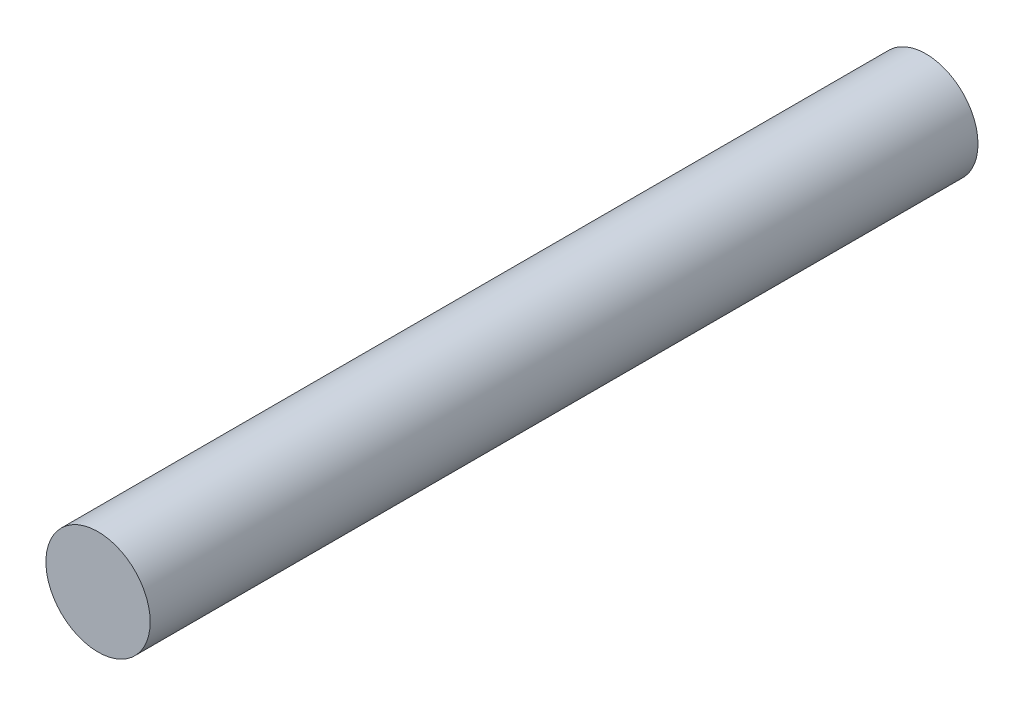
from build123d import *

# Parameters (mm, degrees)
SKETCH1_R           = 1.999996
BOSS_EXTRUDE1_DEPTH = 31.75


with BuildPart() as part:
    # Sketch1 → Boss-Extrude1 (new body)
    with BuildSketch(Plane.XY):
        Circle(SKETCH1_R)
    extrude(amount=BOSS_EXTRUDE1_DEPTH)


solid = part.part
